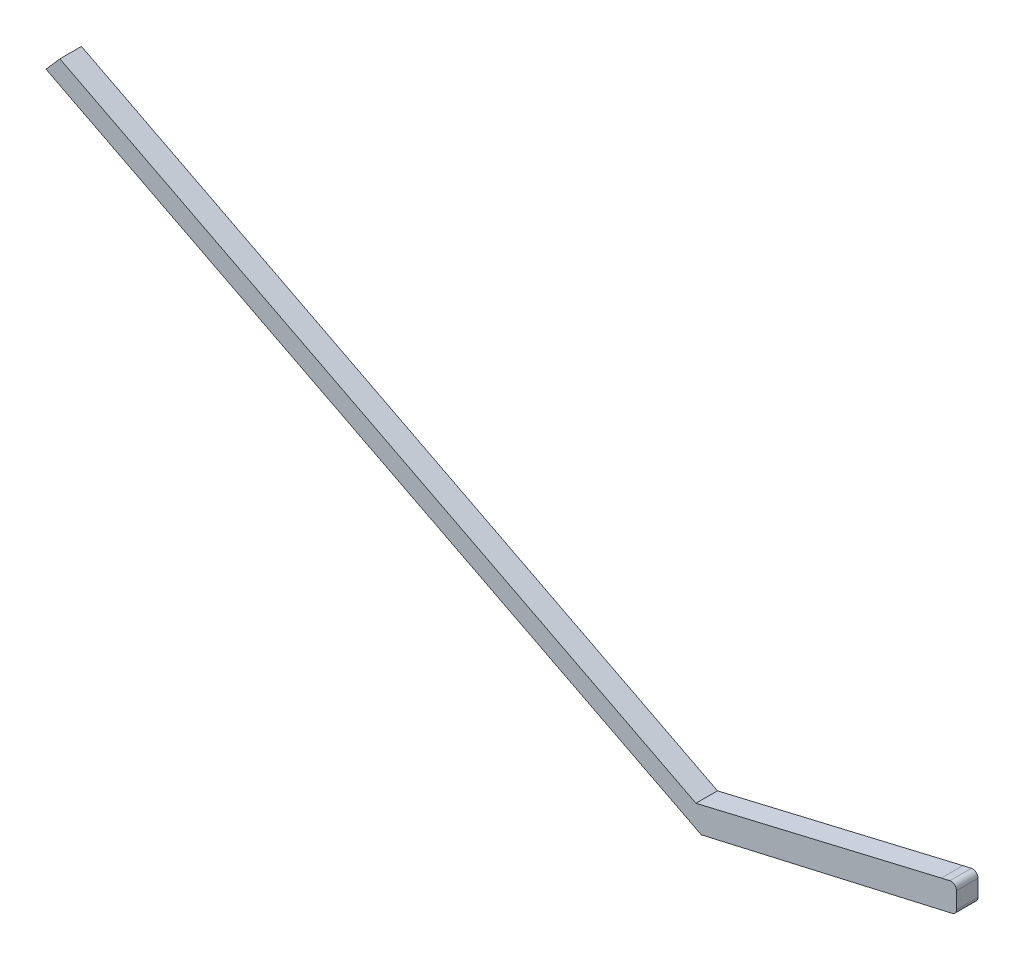
from build123d import *

# Parameters (mm, degrees)
EXTRUDE_1_DEPTH = 2


with BuildPart() as part:
    # 스케치1 → 보스-돌출1 (new body)
    with BuildSketch(Plane.XY):
        with BuildLine():
            Line((-103.31355612, 14.450417953), (-102.023901871, 15.926355594))
            Line((-102.023901871, 15.926355594), (-42.998303114, -14.389807184))
            Line((-42.998303114, -14.389807184), (-20.223148332, -9.012633862))
            Line((-20.223148332, -9.012633862), (-19.43297603, -8.834019872))
            ThreePointArc((-19.43297603, -8.834019872), (-19.009782772, -8.930396085), (-18.821401864, -9.321412122))
            Line((-18.821401864, -9.321412122), (-18.821401864, -10.860213775))
            ThreePointArc((-18.821401864, -10.860213775), (-18.930385827, -11.171832867), (-19.209827698, -11.347606025))
            Line((-19.209827698, -11.347606025), (-20, -11.526220015))
            Line((-20, -11.526220015), (-42.500319357, -16.677300826))
            Line((-42.500319357, -16.677300826), (-103.31355612, 14.450417953))
        make_face()
    extrude(amount=EXTRUDE_1_DEPTH)


solid = part.part
